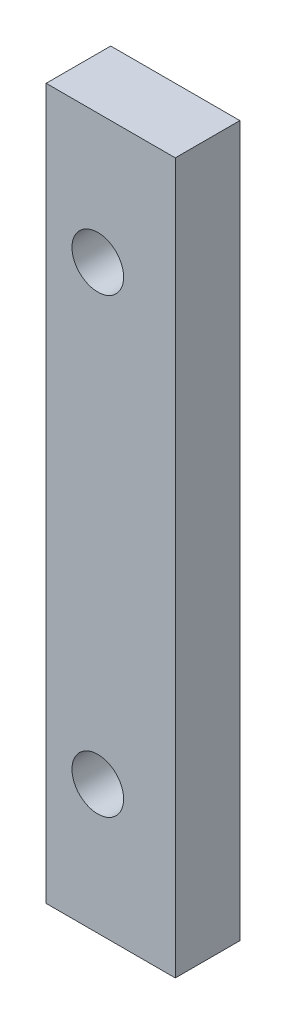
from build123d import *

# Parameters (mm, degrees)
SKETCH1_W           = 10
SKETCH1_H           = 55
SKETCH1_R           = 2
BOSS_EXTRUDE1_DEPTH = 5


with BuildPart() as part:
    # Sketch1 → Boss-Extrude1 (new body)
    with BuildSketch(Plane.XY):
        with Locations((-5, 27.5)):
            Rectangle(SKETCH1_W, SKETCH1_H)
        with Locations((-6, 45)):
            Circle(SKETCH1_R, mode=Mode.SUBTRACT)
        with Locations((-6, 10)):
            Circle(SKETCH1_R, mode=Mode.SUBTRACT)
    extrude(amount=BOSS_EXTRUDE1_DEPTH)


solid = part.part
